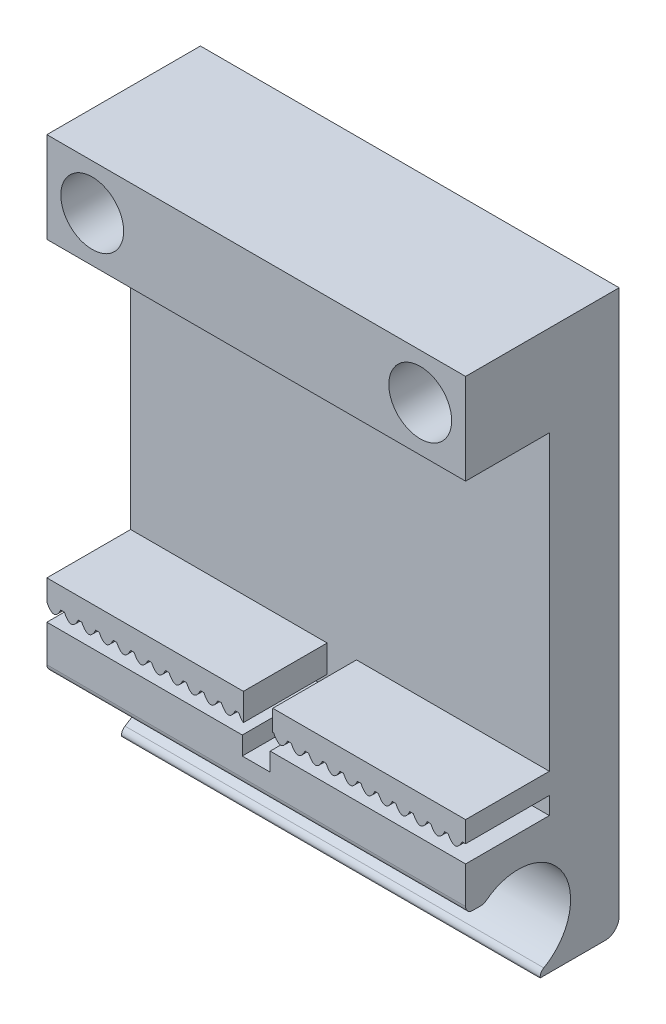
from build123d import *

# Parameters (mm, degrees)
SKETCH_1_W           = 60
SKETCH_1_H           = 80
EXTRUDE_1_DEPTH      = 10
SKETCH_2_W           = 60
SKETCH_2_H           = 13
SKETCH_2_R           = 4
EXTRUDE_2_DEPTH      = 12
SKETCH_3_W           = 60
SKETCH_3_H           = 20
EXTRUDE_3_DEPTH      = 12
SKETCH_6_R           = 7.5
CUT_EXTRUDE_1_DEPTH  = 60
CUT_EXTRUDE_3_DEPTH  = 60
CUT_EXTRUDE_6_DEPTH  = 60
FILLET_11_R          = 1
SKETCH_11_W          = 60
SKETCH_11_H          = 3.5
EXTRUDE_4_DEPTH      = 12
SKETCH_14_W          = 4
SKETCH_14_H          = 1.5
CUT_EXTRUDE_8_DEPTH  = 22
FILLET_12_R          = 2
SKETCH_15_W          = 12
SKETCH_15_H          = 0.5
CUT_EXTRUDE_9_DEPTH  = 103.391405889
EXTRUDE_5_DEPTH      = 20
SKETCH_19_W          = 60
SKETCH_19_H          = 0.5
SKETCH_19_W_2        = 4.202746251
SKETCH_19_H_2        = 4
CUT_EXTRUDE_10_DEPTH = 12
SKETCH_21_W          = 4
SKETCH_21_H          = 1.112257447
CUT_EXTRUDE_12_DEPTH = 103.391405948
SKETCH_22_R          = 4.5
CUT_EXTRUDE_14_DEPTH = 12


with BuildPart() as part:
    # 스케치1 → 보스-돌출1 (new body)
    with BuildSketch(Plane.XY):
        with Locations((-30, 40)):
            Rectangle(SKETCH_1_W, SKETCH_1_H)
    extrude(amount=EXTRUDE_1_DEPTH)

    # 스케치2 → 보스-돌출2 (add)
    with BuildSketch(Plane.XY.offset(10)):
        with Locations((-30, 73.5)):
            Rectangle(SKETCH_2_W, SKETCH_2_H)
        with Locations((-6.5, 73.5)):
            Circle(SKETCH_2_R, mode=Mode.SUBTRACT)
        with Locations((-53.5, 73.5)):
            Circle(SKETCH_2_R, mode=Mode.SUBTRACT)
    extrude(amount=EXTRUDE_2_DEPTH)

    # 스케치3 → 보스-돌출3 (add)
    with BuildSketch(Plane.XY.offset(10)):
        with Locations((-30, 10)):
            Rectangle(SKETCH_3_W, SKETCH_3_H)
    extrude(amount=EXTRUDE_3_DEPTH)

    # 스케치6 → 컷-돌출1 (cut)
    with BuildSketch(Plane(origin=(0, 0, 0), x_dir=(0, 0, -1), z_dir=(1, 0, 0))):
        with Locations(Location((-14.4537136, 7.550140621, 0), (0, 0, 90))):
            Circle(SKETCH_6_R)
    extrude(amount=-CUT_EXTRUDE_1_DEPTH, mode=Mode.SUBTRACT)

    # 스케치8 → 컷-돌출3 (cut)
    with BuildSketch(Plane(origin=(0, 0, 0), x_dir=(0, 0, -1), z_dir=(1, 0, 0))):
        Polygon((-14.254234553, 0), (-22, 0), (-22, 7.752485681), align=None)
    extrude(amount=-CUT_EXTRUDE_3_DEPTH, mode=Mode.SUBTRACT)

    # 스케치10 → 컷-돌출6 (cut)
    with BuildSketch(Plane(origin=(0, 0, 0), x_dir=(0, 0, -1), z_dir=(1, 0, 0))):
        Polygon((-19.367836468, 13.215950046), (-22, 13.215950046), (-22, 7.475911399), align=None)
        Polygon((-11.311841371, 0), (-15.135533844, 0), (-11.311841371, 1.431872303), align=None)
    extrude(amount=-CUT_EXTRUDE_6_DEPTH, mode=Mode.SUBTRACT)

    # 필렛11
    fillet_11_edges = [part.edges().sort_by_distance(p)[0] for p in [
        (-30, 0.739954215, 11.311841371),
        (-30, 13.215950046, 19.367836468),
        (-30, 13.215950046, 22),
    ]]
    fillet(fillet_11_edges, radius=FILLET_11_R)

    # 스케치11 → 보스-돌출4 (add)
    with BuildSketch(Plane.XY.offset(10)):
        with Locations((-30, 23.25)):
            Rectangle(SKETCH_11_W, SKETCH_11_H)
    extrude(amount=EXTRUDE_4_DEPTH)

    # 스케치14 → 컷-돌출8 (cut)
    with BuildSketch(Plane.XY.offset(22)):
        with Locations((-30, 17.637742553)):
            Rectangle(SKETCH_14_W, SKETCH_14_H)
    extrude(amount=-CUT_EXTRUDE_8_DEPTH, mode=Mode.SUBTRACT)

    # 필렛12
    fillet_12_edges = [part.edges().sort_by_distance(p)[0] for p in [
        (-30, 0, 0),
    ]]
    fillet(fillet_12_edges, radius=FILLET_12_R)

    # 스케치15 → 컷-돌출9 (cut, through all)
    with BuildSketch(Plane.ZY.offset(60)):
        with Locations((16, 21.75)):
            Rectangle(SKETCH_15_W, SKETCH_15_H)
    extrude(amount=-CUT_EXTRUDE_9_DEPTH, mode=Mode.SUBTRACT)

    # 스케치18 → 보스-돌출5 (add)
    with BuildSketch(Plane.XY.offset(22)):
        with BuildLine():
            Line((-60, 22), (-58, 22))
            add(Edge.make_bspline(
                [(-60, 22), (-59, 20), (-58, 22)],
                knots=[0, 0, 0, 1, 1, 1], degree=2))
        make_face()
        with BuildLine():
            Line((-57.5, 22), (-55.5, 22))
            add(Edge.make_bspline(
                [(-57.5, 22), (-56.5, 20), (-55.5, 22)],
                knots=[0, 0, 0, 1, 1, 1], degree=2))
        make_face()
        with BuildLine():
            Line((-55, 22), (-53, 22))
            add(Edge.make_bspline(
                [(-55, 22), (-54, 20), (-53, 22)],
                knots=[0, 0, 0, 1, 1, 1], degree=2))
        make_face()
        with BuildLine():
            Line((-52.5, 22), (-50.5, 22))
            add(Edge.make_bspline(
                [(-52.5, 22), (-51.5, 20), (-50.5, 22)],
                knots=[0, 0, 0, 1, 1, 1], degree=2))
        make_face()
        with BuildLine():
            Line((-50, 22), (-48, 22))
            add(Edge.make_bspline(
                [(-50, 22), (-49, 20), (-48, 22)],
                knots=[0, 0, 0, 1, 1, 1], degree=2))
        make_face()
        with BuildLine():
            Line((-47.5, 22), (-45.5, 22))
            add(Edge.make_bspline(
                [(-47.5, 22), (-46.5, 20), (-45.5, 22)],
                knots=[0, 0, 0, 1, 1, 1], degree=2))
        make_face()
        with BuildLine():
            Line((-45, 22), (-43, 22))
            add(Edge.make_bspline(
                [(-45, 22), (-44, 20), (-43, 22)],
                knots=[0, 0, 0, 1, 1, 1], degree=2))
        make_face()
        with BuildLine():
            Line((-42.5, 22), (-40.5, 22))
            add(Edge.make_bspline(
                [(-42.5, 22), (-41.5, 20), (-40.5, 22)],
                knots=[0, 0, 0, 1, 1, 1], degree=2))
        make_face()
        with BuildLine():
            Line((-40, 22), (-38, 22))
            add(Edge.make_bspline(
                [(-40, 22), (-39, 20), (-38, 22)],
                knots=[0, 0, 0, 1, 1, 1], degree=2))
        make_face()
        with BuildLine():
            Line((-37.5, 22), (-35.5, 22))
            add(Edge.make_bspline(
                [(-37.5, 22), (-36.5, 20), (-35.5, 22)],
                knots=[0, 0, 0, 1, 1, 1], degree=2))
        make_face()
        with BuildLine():
            Line((-35, 22), (-33, 22))
            add(Edge.make_bspline(
                [(-35, 22), (-34, 20), (-33, 22)],
                knots=[0, 0, 0, 1, 1, 1], degree=2))
        make_face()
        with BuildLine():
            Line((-32.5, 22), (-30.5, 22))
            add(Edge.make_bspline(
                [(-32.5, 22), (-31.5, 20), (-30.5, 22)],
                knots=[0, 0, 0, 1, 1, 1], degree=2))
        make_face()
        with BuildLine():
            Line((-30, 22), (-28, 22))
            add(Edge.make_bspline(
                [(-30, 22), (-29, 20), (-28, 22)],
                knots=[0, 0, 0, 1, 1, 1], degree=2))
        make_face()
        with BuildLine():
            Line((-27.5, 22), (-25.5, 22))
            add(Edge.make_bspline(
                [(-27.5, 22), (-26.5, 20), (-25.5, 22)],
                knots=[0, 0, 0, 1, 1, 1], degree=2))
        make_face()
        with BuildLine():
            Line((-25, 22), (-23, 22))
            add(Edge.make_bspline(
                [(-25, 22), (-24, 20), (-23, 22)],
                knots=[0, 0, 0, 1, 1, 1], degree=2))
        make_face()
        with BuildLine():
            Line((-22.5, 22), (-20.5, 22))
            add(Edge.make_bspline(
                [(-22.5, 22), (-21.5, 20), (-20.5, 22)],
                knots=[0, 0, 0, 1, 1, 1], degree=2))
        make_face()
        with BuildLine():
            Line((-20, 22), (-18, 22))
            add(Edge.make_bspline(
                [(-20, 22), (-19, 20), (-18, 22)],
                knots=[0, 0, 0, 1, 1, 1], degree=2))
        make_face()
        with BuildLine():
            Line((-17.5, 22), (-15.5, 22))
            add(Edge.make_bspline(
                [(-17.5, 22), (-16.5, 20), (-15.5, 22)],
                knots=[0, 0, 0, 1, 1, 1], degree=2))
        make_face()
        with BuildLine():
            Line((-15, 22), (-13, 22))
            add(Edge.make_bspline(
                [(-15, 22), (-14, 20), (-13, 22)],
                knots=[0, 0, 0, 1, 1, 1], degree=2))
        make_face()
        with BuildLine():
            Line((-12.5, 22), (-10.5, 22))
            add(Edge.make_bspline(
                [(-12.5, 22), (-11.5, 20), (-10.5, 22)],
                knots=[0, 0, 0, 1, 1, 1], degree=2))
        make_face()
        with BuildLine():
            Line((-10, 22), (-8, 22))
            add(Edge.make_bspline(
                [(-10, 22), (-9, 20), (-8, 22)],
                knots=[0, 0, 0, 1, 1, 1], degree=2))
        make_face()
        with BuildLine():
            Line((-7.5, 22), (-5.5, 22))
            add(Edge.make_bspline(
                [(-7.5, 22), (-6.5, 20), (-5.5, 22)],
                knots=[0, 0, 0, 1, 1, 1], degree=2))
        make_face()
        with BuildLine():
            Line((-5, 22), (-3, 22))
            add(Edge.make_bspline(
                [(-5, 22), (-4, 20), (-3, 22)],
                knots=[0, 0, 0, 1, 1, 1], degree=2))
        make_face()
        with BuildLine():
            Line((-2.5, 22), (-0.5, 22))
            add(Edge.make_bspline(
                [(-2.5, 22), (-1.5, 20), (-0.5, 22)],
                knots=[0, 0, 0, 1, 1, 1], degree=2))
        make_face()
    extrude(amount=-EXTRUDE_5_DEPTH)

    # 스케치19 → 컷-돌출10 (cut)
    with BuildSketch(Plane.XY.offset(22)):
        with Locations((-30, 19.75)):
            Rectangle(SKETCH_19_W, SKETCH_19_H)
        with Locations((-29.736082812, 23)):
            Rectangle(SKETCH_19_W_2, SKETCH_19_H_2)
    extrude(amount=-CUT_EXTRUDE_10_DEPTH, mode=Mode.SUBTRACT)

    # 스케치21 → 컷-돌출12 (cut, through all)
    with BuildSketch(Plane.XY.offset(22)):
        with Locations((-30, 18.943871277)):
            Rectangle(SKETCH_21_W, SKETCH_21_H)
    extrude(amount=-CUT_EXTRUDE_12_DEPTH, mode=Mode.SUBTRACT)

    # 스케치22 → 컷-돌출14 (cut)
    with BuildSketch(Plane.XY.offset(22)):
        with Locations((-53.5, 73.5)):
            Circle(SKETCH_22_R)
        with Locations((-6.5, 73.5)):
            Circle(SKETCH_22_R)
    extrude(amount=-CUT_EXTRUDE_14_DEPTH, mode=Mode.SUBTRACT)


solid = part.part
